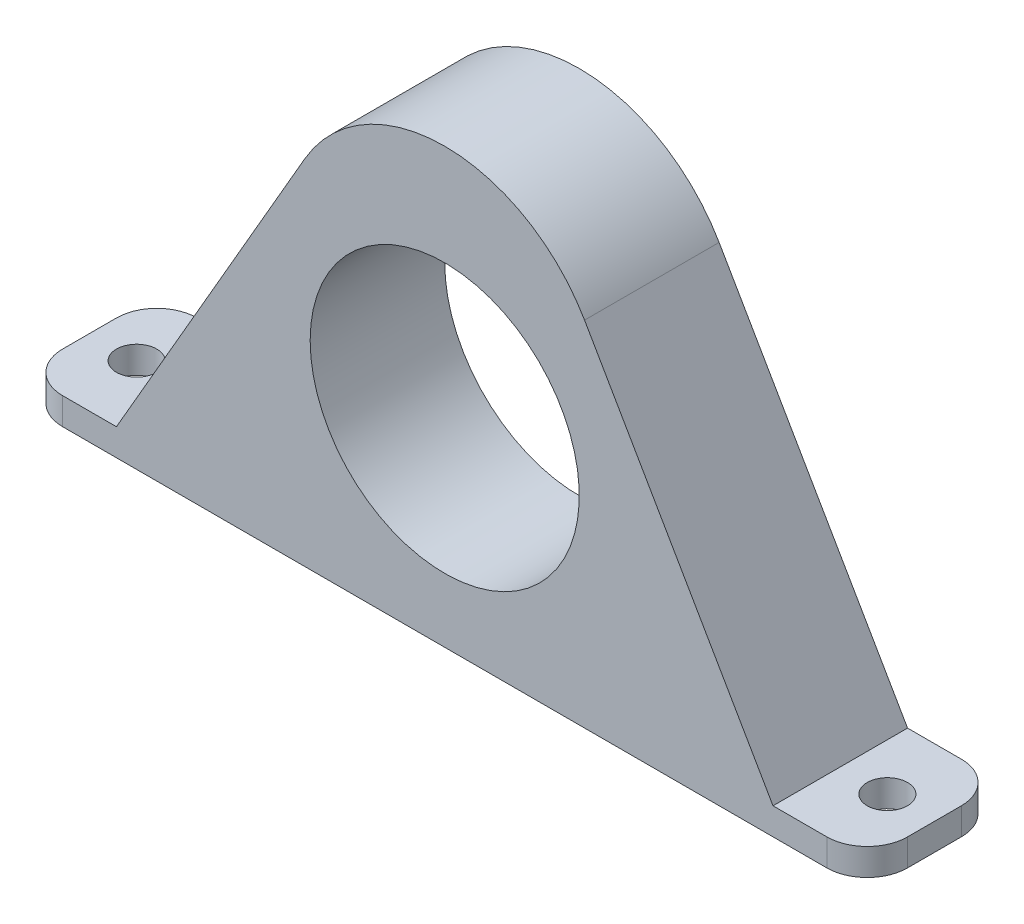
from build123d import *

# Parameters (mm, degrees)
SALIENTE_EXTRUIR3_DEPTH = 10
CROQUIS3_R              = 10
CORTAR_EXTRUIR1_DEPTH   = 10
REDONDEO2_R             = 12
CROQUIS4_R              = 1.5
CORTAR_EXTRUIR2_DEPTH   = 45.733638102
REDONDEO3_R             = 3


with BuildPart() as part:
    # Croquis1 → Saliente-Extruir3 (new body)
    with BuildSketch(Plane.XY):
        Polygon((0, 29.5), (-24.396106146, -12.755295351), (-31.396106146, -12.755295351), (-31.396106146, -14.755295351), (-25.556921229, -14.755295351), (25.556921229, -14.755295351), (31.396106146, -14.755295351), (31.396106146, -12.755295351), (24.396106146, -12.755295351), align=None)
    extrude(amount=SALIENTE_EXTRUIR3_DEPTH)

    # Croquis3 → Cortar-Extruir1 (cut)
    with BuildSketch(Plane(origin=(0, 0, 0), x_dir=(-1, 0, 0), z_dir=(0, 0, -1))):
        Circle(CROQUIS3_R)
    extrude(amount=-CORTAR_EXTRUIR1_DEPTH, mode=Mode.SUBTRACT)

    # Redondeo2
    redondeo2_edges = [part.edges().sort_by_distance(p)[0] for p in [
        (0, 29.5, 5),
    ]]
    fillet(redondeo2_edges, radius=REDONDEO2_R)

    # Croquis4 → Cortar-Extruir2 (cut, through all)
    with BuildSketch(Plane(origin=(0, -12.755295351, 0), x_dir=(1, 0, 0), z_dir=(0, 1, 0))):
        with Locations(Location((27.896106146, -5, 0), (0, 0, 180))):
            Circle(CROQUIS4_R)
        with Locations(Location((-27.896106146, -5, 0), (0, 0, 180))):
            Circle(CROQUIS4_R)
    extrude(amount=-CORTAR_EXTRUIR2_DEPTH, mode=Mode.SUBTRACT)

    # Redondeo3
    redondeo3_edges = [part.edges().sort_by_distance(p)[0] for p in [
        (-31.396106146, -13.755295351, 10),
        (-31.396106146, -13.755295351, 0),
        (31.396106146, -13.755295351, 10),
        (31.396106146, -13.755295351, 0),
    ]]
    fillet(redondeo3_edges, radius=REDONDEO3_R)


solid = part.part
